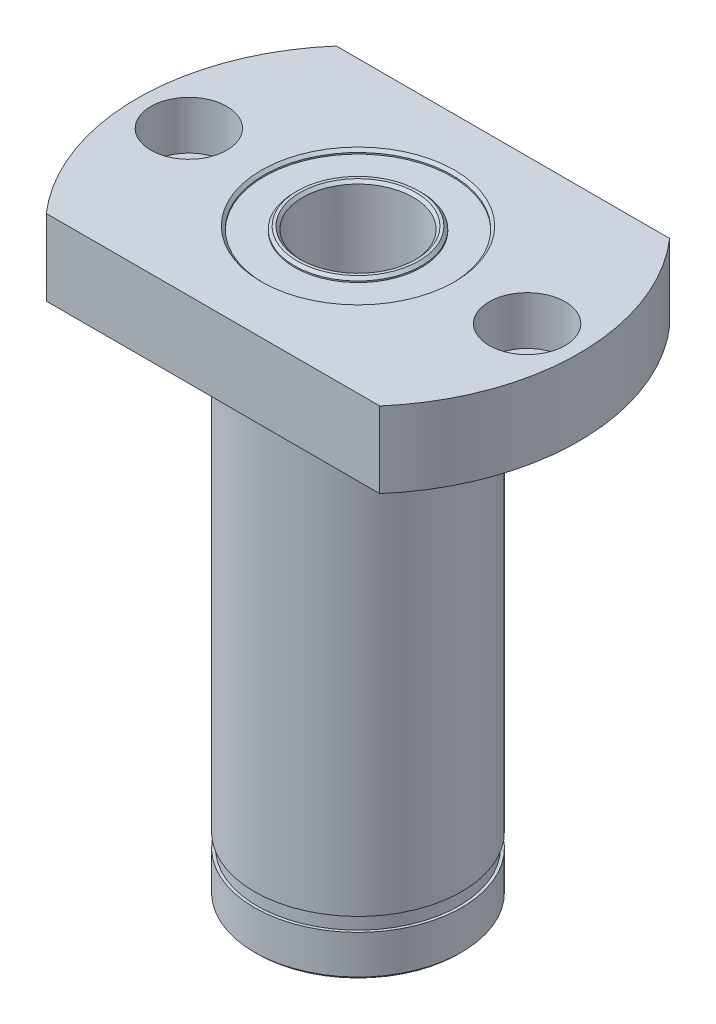
from build123d import *

# Parameters (mm, degrees)
SKETCH1_R      = 7.5
EXTRUDE1_DEPTH = 36.5
SKETCH2_W      = 32
SKETCH2_H      = 21
EXTRUDE2_DEPTH = 5.5
SKETCH3_R      = 4
EXTRUDE3_DEPTH = 42
SKETCH4_R      = 21
SKETCH4_R_2    = 16
EXTRUDE4_DEPTH = 10
SKETCH5_R      = 6.8
SKETCH5_R_2    = 4.6
EXTRUDE5_DEPTH = 0.3
EXTRUDE6_START = -0.3
SKETCH6_R      = 6.8
SKETCH6_R_2    = 4.6
EXTRUDE6_DEPTH = 0.3
SKETCH7_W      = 0.2
SKETCH7_H      = 1
SKETCH8_R      = 1.5
EXTRUDE7_DEPTH = 8
SKETCH8_3_R    = 2.75
EXTRUDE8_DEPTH = 3.5
CHAMFER1_SIZE  = 0.2


with BuildPart() as part:
    # Sketch1 → Extrude1 (new body)
    with BuildSketch(Plane(origin=(0, 0, 0), x_dir=(1, 0, 0), z_dir=(0, 1, 0))):
        Circle(SKETCH1_R)
    extrude(amount=EXTRUDE1_DEPTH)

    # Sketch2 → Extrude2 (add)
    with BuildSketch(Plane(origin=(0, 36.5, 0), x_dir=(1, 0, 0), z_dir=(0, 1, 0))):
        Rectangle(SKETCH2_W, SKETCH2_H)
    extrude(amount=EXTRUDE2_DEPTH)

    # Sketch3 → Extrude3 (cut)
    with BuildSketch(Plane.XZ):
        Circle(SKETCH3_R)
    extrude(amount=-EXTRUDE3_DEPTH, mode=Mode.SUBTRACT)

    # Sketch4 → Extrude4 (cut)
    with BuildSketch(Plane(origin=(0, 42, 0), x_dir=(1, 0, 0), z_dir=(0, 1, 0))):
        Circle(SKETCH4_R)
        Circle(SKETCH4_R_2, mode=Mode.SUBTRACT)
    extrude(amount=-EXTRUDE4_DEPTH, mode=Mode.SUBTRACT)

    # Sketch5 → Extrude5 (cut)
    with BuildSketch(Plane.XZ):
        Circle(SKETCH5_R)
        Circle(SKETCH5_R_2, mode=Mode.SUBTRACT)
    extrude(amount=-EXTRUDE5_DEPTH, mode=Mode.SUBTRACT)

    # Sketch6 → Extrude6 (cut)
    with BuildSketch(Plane(origin=(0, 42, 0), x_dir=(1, 0, 0), z_dir=(0, 1, 0)).offset(EXTRUDE6_START)):
        Circle(SKETCH6_R)
        Circle(SKETCH6_R_2, mode=Mode.SUBTRACT)
    extrude(amount=EXTRUDE6_DEPTH, mode=Mode.SUBTRACT)

    # Sketch7 → Cut-Revolve1 (revolve, cut)
    with BuildSketch(Plane(origin=(0, 0, 0), x_dir=(0, 0, -1), z_dir=(1, 0, 0))):
        with Locations((7.4, 3.5)):
            Rectangle(SKETCH7_W, SKETCH7_H)
    revolve(axis=Axis((0, 0, 0), (0, 1, 0)), mode=Mode.SUBTRACT)

    # Sketch8 → Extrude7 (cut)
    with BuildSketch(Plane(origin=(0, 42, 0), x_dir=(1, 0, 0), z_dir=(0, 1, 0))):
        with Locations((-12.25, 0)):
            Circle(SKETCH8_R)
        with Locations((12.25, 0)):
            Circle(SKETCH8_R)
    extrude(amount=-EXTRUDE7_DEPTH, mode=Mode.SUBTRACT)

    # Sketch8<3> → Extrude8 (cut)
    with BuildSketch(Plane(origin=(0, 42, 0), x_dir=(1, 0, 0), z_dir=(0, 1, 0))):
        with Locations((-12.25, 0)):
            Circle(SKETCH8_3_R)
        with Locations((12.25, 0)):
            Circle(SKETCH8_3_R)
    extrude(amount=-EXTRUDE8_DEPTH, mode=Mode.SUBTRACT)

    # Chamfer1
    chamfer1_edges = [part.edges().sort_by_distance(p)[0] for p in [
        (-4, 0, 0),
        (-7.5, 0, 0),
        (-4.6, 0, 0),
        (-6.8, 0, 0),
        (-4.6, 42, 0),
        (-4, 42, 0),
        (-6.8, 42, 0),
    ]]
    chamfer(chamfer1_edges, length=CHAMFER1_SIZE)


solid = part.part
